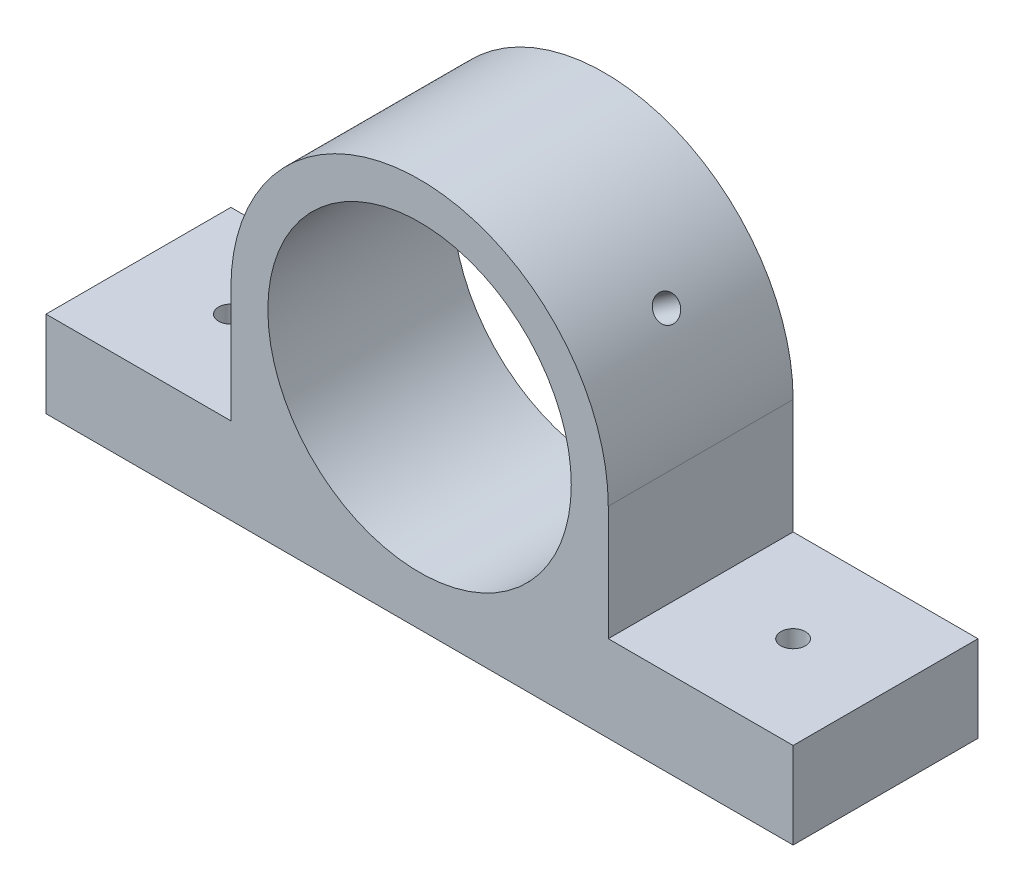
from build123d import *

# Parameters (mm, degrees)
BOSS_EXTRUDE1_DEPTH = 15
BOSS_EXTRUDE2_START = -15
BOSS_EXTRUDE2_DEPTH = 15
SKETCH2_R           = 1
CUT_EXTRUDE1_DEPTH  = 25
SKETCH5_R           = 1
CUT_EXTRUDE2_DEPTH  = 4
SKETCH6_R           = 1
CUT_EXTRUDE3_DEPTH  = 4


with BuildPart() as part:
    # Sketch1 → Boss-Extrude1 (new body)
    with BuildSketch(Plane.XY):
        with BuildLine():
            Line((-12.31, 0), (-12.31, -12.31))
            Line((-12.31, -12.31), (-30.31, -12.31))
            Line((-30.31, -12.31), (-30.31, -9.31))
            Line((-30.31, -9.31), (-15.31, -9.31))
            Line((-15.31, -9.31), (-15.31, 0))
            ThreePointArc((-15.31, 0), (0, 15.31), (15.31, 0))
            Line((15.31, 0), (15.31, -9.31))
            Line((15.31, -9.31), (30.31, -9.31))
            Line((30.31, -9.31), (30.31, -12.31))
            Line((30.31, -12.31), (12.31, -12.31))
            Line((12.31, -12.31), (12.31, 0))
            ThreePointArc((12.31, 0), (0, 12.31), (-12.31, 0))
        make_face()
    extrude(amount=BOSS_EXTRUDE1_DEPTH)

    # Sketch3 → Boss-Extrude2 (add)
    with BuildSketch(Plane.XY.offset(15).offset(BOSS_EXTRUDE2_START)):
        with BuildLine():
            Line((-30.31, -12.31), (-12.31, -12.31))
            Line((-12.31, -12.31), (-12.31, 0))
            ThreePointArc((-12.31, 0), (0, -12.31), (12.31, 0))
            Line((12.31, 0), (12.31, -12.31))
            Line((12.31, -12.31), (30.31, -12.31))
            Line((30.31, -12.31), (30.31, -16.31))
            Line((30.31, -16.31), (-30.31, -16.31))
            Line((-30.31, -16.31), (-30.31, -12.31))
        make_face()
    extrude(amount=BOSS_EXTRUDE2_DEPTH)

    # Sketch2 → Cut-Extrude1 (cut)
    with BuildSketch(Plane(origin=(0, -9.31, 0), x_dir=(1, 0, 0), z_dir=(0, 1, 0))):
        with Locations(Location((22.81, -7.5, 0), (0, 0, 270))):
            Circle(SKETCH2_R)
        with Locations(Location((-22.81, -7.5, 0), (0, 0, 270))):
            Circle(SKETCH2_R)
    extrude(amount=-CUT_EXTRUDE1_DEPTH, mode=Mode.SUBTRACT)

    # Sketch5 → Cut-Extrude2 (cut)
    with BuildSketch(Plane(origin=(12.541217798, 8.781455241, 0), x_dir=(0, 0, -1), z_dir=(0.819152044288993, 0.5735764363510446, 0))):
        with Locations(Location((-7.5, 0, 0), (0, 0, 90))):
            Circle(SKETCH5_R)
    extrude(amount=-CUT_EXTRUDE2_DEPTH, mode=Mode.SUBTRACT)

    # Sketch6 → Cut-Extrude3 (cut)
    with BuildSketch(Plane(origin=(-12.541217798, 8.781455241, 0), x_dir=(0, 0, 1), z_dir=(-0.8191520442889931, 0.5735764363510442, 0))):
        with Locations(Location((7.5, 0, 0), (0, 0, 270))):
            Circle(SKETCH6_R)
    extrude(amount=-CUT_EXTRUDE3_DEPTH, mode=Mode.SUBTRACT)


solid = part.part
